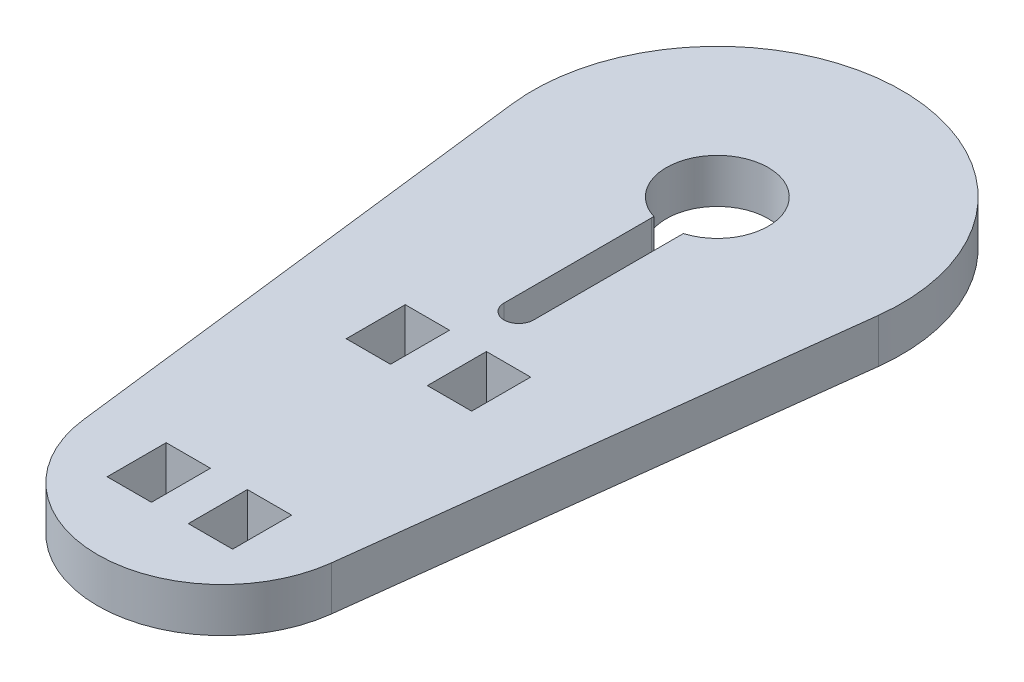
from build123d import *

# Parameters (mm, degrees)
SKETCH1_W           = 3
SKETCH1_H           = 4
BOSS_EXTRUDE2_DEPTH = 3
FILLET1_R           = 8.464107


with BuildPart() as part:
    # Sketch1 → Boss-Extrude2 (new body)
    with BuildSketch(Plane(origin=(0, 0, 0), x_dir=(1, 0, 0), z_dir=(0, 1, 0))):
        with BuildLine():
            Line((-7.5, -42), (7.5, -42))
            Line((7.5, -42), (12.409150917, -1.504318289))
            ThreePointArc((12.409150917, -1.504318289), (0, 12.5), (-12.409150917, -1.504318289))
            Line((-12.409150917, -1.504318289), (-7.5, -42))
        make_face()
        with BuildLine():
            ThreePointArc((-1, -3.45), (-0.997357075, -3.377344208), (-0.989442272, -3.305072464))
            ThreePointArc((-0.989442272, -3.305072464), (0, 3.45), (0.989442272, -3.305072464))
            ThreePointArc((0.989442272, -3.305072464), (0.997357075, -3.377344208), (1, -3.45))
            Line((1, -3.45), (1, -13.45))
            ThreePointArc((1, -13.45), (0, -14.45), (-1, -13.45))
            Line((-1, -13.45), (-1, -3.45))
        make_face(mode=Mode.SUBTRACT)
        with Locations((-2.75, -35.1)):
            Rectangle(SKETCH1_W, SKETCH1_H, mode=Mode.SUBTRACT)
        with Locations((-2.75, -18.9)):
            Rectangle(SKETCH1_W, SKETCH1_H, mode=Mode.SUBTRACT)
        with Locations((2.75, -35.1)):
            Rectangle(SKETCH1_W, SKETCH1_H, mode=Mode.SUBTRACT)
        with Locations((2.75, -18.9)):
            Rectangle(SKETCH1_W, SKETCH1_H, mode=Mode.SUBTRACT)
    extrude(amount=BOSS_EXTRUDE2_DEPTH)

    # Fillet1
    fillet1_edges = [part.edges().sort_by_distance(p)[0] for p in [
        (-7.5, 1.5, 42),
        (7.5, 1.5, 42),
    ]]
    fillet(fillet1_edges, radius=FILLET1_R)


solid = part.part
